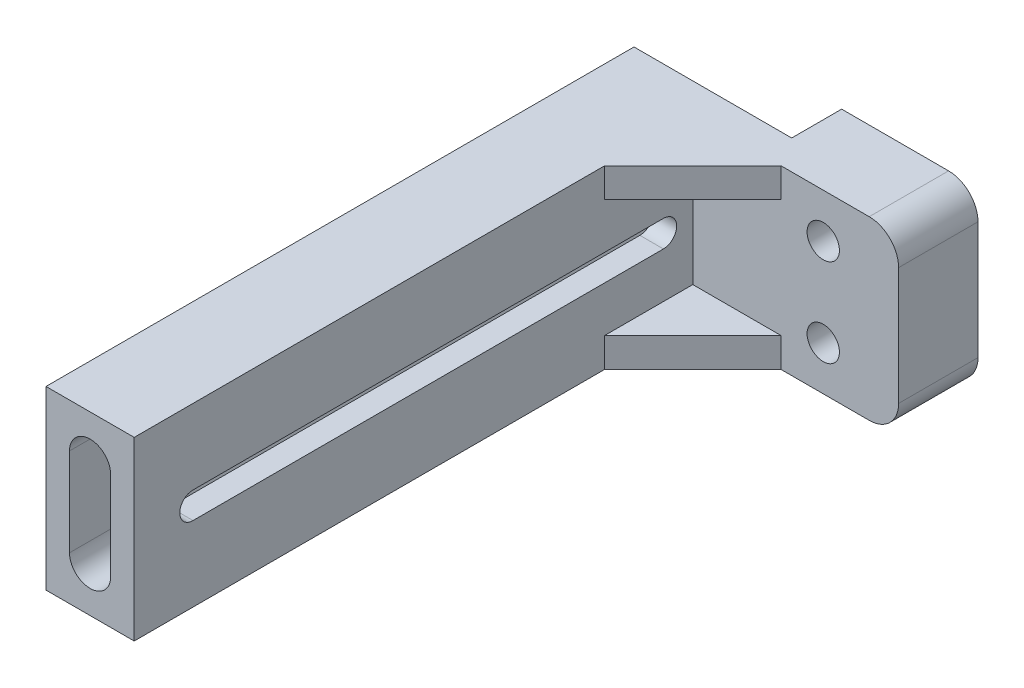
from build123d import *

# Parameters (mm, degrees)
SKETCH3_W           = 15
SKETCH3_H           = 30
BOSS_EXTRUDE2_DEPTH = 100
CUT_EXTRUDE1_DEPTH  = 104.591746776
BOSS_EXTRUDE3_DEPTH = 5
BOSS_EXTRUDE4_START = 8.5
BOSS_EXTRUDE4_DEPTH = 8.5
FILLET1_R           = 5
SKETCH8_W           = 20
SKETCH8_H           = 13.5
CUT_EXTRUDE3_DEPTH  = 113.722003176
SKETCH10_W          = 5
SKETCH10_H          = 30
BOSS_EXTRUDE5_DEPTH = 35
BOSS_EXTRUDE6_DEPTH = 8.5
SKETCH12_R          = 2.75
CUT_EXTRUDE4_DEPTH  = 119.679189414
FILLET2_R           = 5
BOSS_EXTRUDE7_DEPTH = 5
BOSS_EXTRUDE8_DEPTH = 5


with BuildPart() as part:
    # Sketch3 → Boss-Extrude2 (new body)
    with BuildSketch(Plane.XY):
        with Locations((0, 7.5)):
            Rectangle(SKETCH3_W, SKETCH3_H)
        with BuildLine():
            Line((-3.5, 0), (-3.5, 15))
            ThreePointArc((-3.5, 15), (0, 18.5), (3.5, 15))
            Line((3.5, 15), (3.5, 0))
            ThreePointArc((3.5, 0), (0, -3.5), (-3.5, 0))
        make_face(mode=Mode.SUBTRACT)
    extrude(amount=BOSS_EXTRUDE2_DEPTH)

    # Sketch4 → Cut-Extrude1 (cut, through all)
    with BuildSketch(Plane.ZY.offset(7.5)):
        with BuildLine():
            Line((10, 9.75), (90, 9.75))
            ThreePointArc((90, 9.75), (92.25, 7.5), (90, 5.25))
            Line((90, 5.25), (10, 5.25))
            ThreePointArc((10, 5.25), (7.75, 7.5), (10, 9.75))
        make_face()
    extrude(amount=-CUT_EXTRUDE1_DEPTH, mode=Mode.SUBTRACT)

    # Sketch5 → Boss-Extrude3 (add)
    with BuildSketch(Plane(origin=(0, 0, 0), x_dir=(-1, 0, 0), z_dir=(0, 0, -1))):
        with BuildLine():
            Line((-7.5, -7.5), (-7.5, 7.5))
            Line((-7.5, 7.5), (-7.5, 22.5))
            Line((-7.5, 22.5), (-14, 22.5))
            Line((-14, 22.5), (-37.5, 22.5))
            ThreePointArc((-37.5, 22.5), (-41.035533906, 21.035533906), (-42.5, 17.5))
            Line((-42.5, 17.5), (-42.5, -2.5))
            ThreePointArc((-42.5, -2.5), (-41.035533906, -6.035533906), (-37.5, -7.5))
            Line((-37.5, -7.5), (-14, -7.5))
            Line((-14, -7.5), (-7.5, -7.5))
        make_face()
    extrude(amount=-BOSS_EXTRUDE3_DEPTH)

    # Sketch6 → Boss-Extrude4 (add)
    with BuildSketch(Plane(origin=(0, 0, 0), x_dir=(-1, 0, 0), z_dir=(0, 0, -1)).offset(BOSS_EXTRUDE4_START)):
        with BuildLine():
            Line((-8.122776602, 22.5), (-37.5, 22.5))
            ThreePointArc((-37.5, 22.5), (-41.035533906, 21.035533906), (-42.5, 17.5))
            Line((-42.5, 17.5), (-42.5, -2.5))
            ThreePointArc((-42.5, -2.5), (-41.035533906, -6.035533906), (-37.5, -7.5))
            Line((-37.5, -7.5), (-8.122776602, -7.5))
            ThreePointArc((-8.122776602, -7.5), (-11.5, 7.5), (-8.122776602, 22.5))
        make_face()
    extrude(amount=-BOSS_EXTRUDE4_DEPTH)

    # Fillet1
    fillet1_edges = [part.edges().sort_by_distance(p)[0] for p in [
        (8.122776602, -7.5, -4.25),
        (8.122776602, 22.5, -4.25),
    ]]
    fillet(fillet1_edges, radius=FILLET1_R)

    # Sketch8 → Cut-Extrude3 (cut, through all)
    with BuildSketch(Plane(origin=(0, 22.5, 0), x_dir=(1, 0, 0), z_dir=(0, 1, 0))):
        with Locations((17.5, 1.75)):
            Rectangle(SKETCH8_W, SKETCH8_H)
    extrude(amount=-CUT_EXTRUDE3_DEPTH, mode=Mode.SUBTRACT)


with BuildPart() as cut_extrude3_piece_1:
    # of the separate pieces the step leaves, piece 1, a body of its own (cut_extrude3_pieces)
    add(part.part.solids().sort_by_distance((-7.5, -7.5, 100))[0])

    # Sketch10 → Boss-Extrude5 (add)
    with BuildSketch(Plane(origin=(7.5, 0, 0), x_dir=(0, 0, -1), z_dir=(1, 0, 0))):
        with Locations((-2.5, 7.5)):
            Rectangle(SKETCH10_W, SKETCH10_H)
    extrude(amount=BOSS_EXTRUDE5_DEPTH)

    # Sketch11 → Boss-Extrude6 (add)
    with BuildSketch(Plane(origin=(0, 0, 0), x_dir=(-1, 0, 0), z_dir=(0, 0, -1))):
        with BuildLine():
            Line((-42.5, -7.5), (-22.5, -7.5))
            Line((-22.5, -7.5), (-19.314112746, -7.5))
            ThreePointArc((-19.314112746, -7.5), (-21.865716684, 7.5), (-19.314112746, 22.5))
            Line((-19.314112746, 22.5), (-22.5, 22.5))
            Line((-22.5, 22.5), (-42.5, 22.5))
            Line((-42.5, 22.5), (-42.5, -7.5))
        make_face()
    extrude(amount=BOSS_EXTRUDE6_DEPTH)

    # Sketch12 → Cut-Extrude4 (cut, through all)
    with BuildSketch(Plane(origin=(0, 0, -8.5), x_dir=(-1, 0, 0), z_dir=(0, 0, -1))):
        with Locations((-29.682858342, 0)):
            Circle(SKETCH12_R)
        with Locations((-29.682858342, 15)):
            Circle(SKETCH12_R)
    extrude(amount=-CUT_EXTRUDE4_DEPTH, mode=Mode.SUBTRACT)

    # Fillet2
    fillet2_edges = [cut_extrude3_piece_1.edges().sort_by_distance(p)[0] for p in [
        (42.5, -7.5, -1.75),
        (42.5, 22.5, -1.75),
    ]]
    fillet(fillet2_edges, radius=FILLET2_R)

    # Sketch13 → Boss-Extrude7 (add)
    with BuildSketch(Plane.XZ.offset(7.5)):
        Polygon((7.5, 5), (7.5, 20), (22.5, 5), align=None)
    extrude(amount=-BOSS_EXTRUDE7_DEPTH)

    # Sketch14 → Boss-Extrude8 (add)
    with BuildSketch(Plane(origin=(0, 22.5, 0), x_dir=(1, 0, 0), z_dir=(0, 1, 0))):
        Polygon((22.5, -5), (7.5, -5), (7.5, -20), align=None)
    extrude(amount=-BOSS_EXTRUDE8_DEPTH)


with BuildPart() as cut_extrude3_piece_2:
    # of the separate pieces the step leaves, piece 2, a body of its own (cut_extrude3_pieces)
    add(part.part.solids().sort_by_distance((37.5, -7.5, -8.5))[0])


solid = cut_extrude3_piece_1.part
